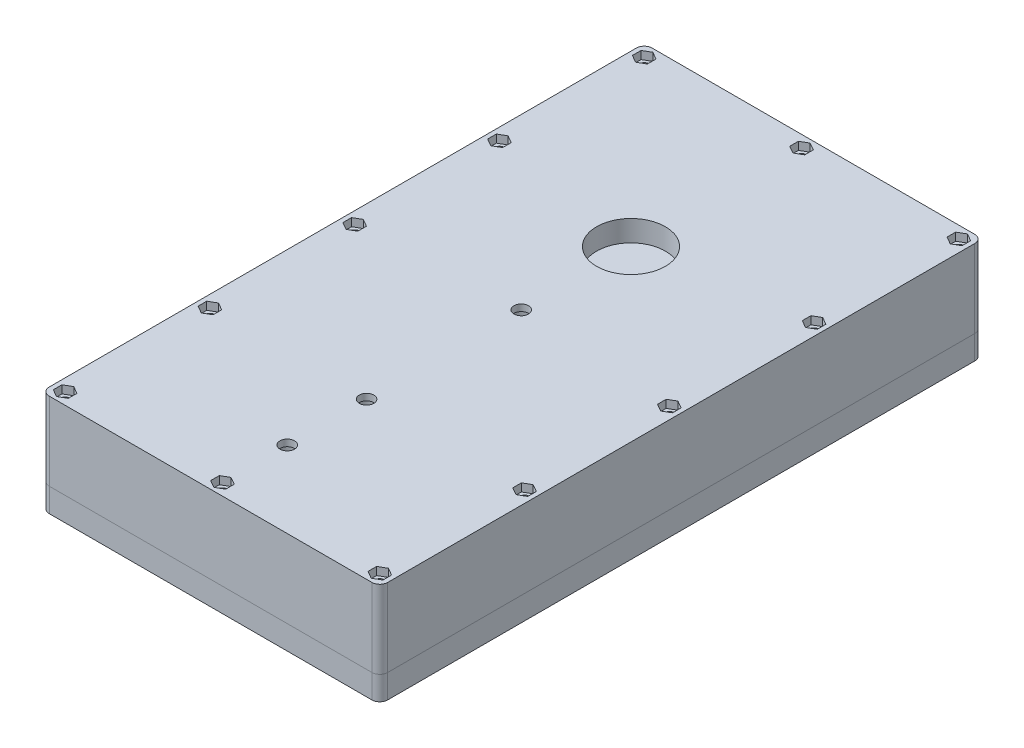
from build123d import *

# Parameters (mm, degrees)
SKETCH1_W                = 110
SKETCH1_H                = 210
SKETCH1_R                = 3.15
SKETCH1_R_2              = 2.75
SKETCH1_R_3              = 13
BOSS_EXTRUDE1_DEPTH      = 8
BOSS_EXTRUDE2_DEPTH      = 21.5
BOSS_EXTRUDE2_DEPTH_BACK = 8
SKETCH2_W                = 128
SKETCH2_H                = 228
SKETCH2_R                = 1.75
SKETCH2_W_2              = 110
SKETCH2_H_2              = 210
SKETCH3_W                = 128
SKETCH3_H                = 228
SKETCH3_R                = 11.5
SKETCH3_R_2              = 1.75
SKETCH3_R_3              = 3.15
SKETCH3_R_4              = 5.25
BOSS_EXTRUDE3_DEPTH      = 9
SKETCH4_R                = 2.86
CUT_EXTRUDE1_DEPTH       = 3.5
SKETCH5_R                = 2.75
CUT_EXTRUDE2_DEPTH       = 157.036053526
SKETCH6_R                = 4.36
CUT_EXTRUDE3_DEPTH       = 5.5
SKETCH7_R                = 7.5
SKETCH7_R_2              = 2.75
BOSS_EXTRUDE4_DEPTH      = 22.5
BOSS_EXTRUDE4_2_DEPTH    = 22.5
FILLET1_R                = 3
FILLET2_R                = 3
SKETCH8_R                = 3.15
BOSS_EXTRUDE5_DEPTH      = 3
BOSS_EXTRUDE6_START      = -3
SKETCH9_R                = 3.15
BOSS_EXTRUDE6_DEPTH      = 3
CUT_EXTRUDE4_DEPTH       = 3
CHAMFER1_SIZE            = 2
CHAMFER2_SIZE            = 1
CHAMFER3_SIZE            = 1


with BuildPart() as part:
    # Sketch1 → Boss-Extrude1 (new body)
    with BuildSketch(Plane(origin=(0, 0, 0), x_dir=(1, 0, 0), z_dir=(0, 1, 0))):
        with Locations((0, 25)):
            Rectangle(SKETCH1_W, SKETCH1_H)
        with Locations(Location((0, 0, 0), (0, 0, 270))):
            Circle(SKETCH1_R, mode=Mode.SUBTRACT)
        with Locations(Location((0, -60, 0), (0, 0, 270))):
            Circle(SKETCH1_R_2, mode=Mode.SUBTRACT)
        with Locations(Location((0, 70, 0), (0, 0, 270))):
            Circle(SKETCH1_R_3, mode=Mode.SUBTRACT)
    extrude(amount=BOSS_EXTRUDE1_DEPTH)

    # Sketch2 → Boss-Extrude2 (add, two sides: drawn at the far end of the back side and taken through both)
    with BuildSketch(Plane.XZ.offset(-BOSS_EXTRUDE2_DEPTH_BACK)):
        with Locations((0, -25)):
            Rectangle(SKETCH2_W, SKETCH2_H)
        with Locations(Location((-59.5, -79.75, 0), (0, 0, 270))):
            Circle(SKETCH2_R, mode=Mode.SUBTRACT)
        with Locations(Location((59.5, 84.5, 0), (0, 0, 270))):
            Circle(SKETCH2_R, mode=Mode.SUBTRACT)
        with Locations(Location((59.5, 29.75, 0), (0, 0, 270))):
            Circle(SKETCH2_R, mode=Mode.SUBTRACT)
        with Locations(Location((0, 84.5, 0), (0, 0, 270))):
            Circle(SKETCH2_R, mode=Mode.SUBTRACT)
        with Locations(Location((-59.5, 29.75, 0), (0, 0, 270))):
            Circle(SKETCH2_R, mode=Mode.SUBTRACT)
        with Locations(Location((-59.5, -25, 0), (0, 0, 270))):
            Circle(SKETCH2_R, mode=Mode.SUBTRACT)
        with Locations(Location((-59.5, 84.5, 0), (0, 0, 270))):
            Circle(SKETCH2_R, mode=Mode.SUBTRACT)
        with Locations(Location((59.5, -25, 0), (0, 0, 270))):
            Circle(SKETCH2_R, mode=Mode.SUBTRACT)
        with Locations(Location((59.5, -134.5, 0), (0, 0, 270))):
            Circle(SKETCH2_R, mode=Mode.SUBTRACT)
        with Locations(Location((59.5, -79.75, 0), (0, 0, 270))):
            Circle(SKETCH2_R, mode=Mode.SUBTRACT)
        with Locations(Location((0, -134.5, 0), (0, 0, 270))):
            Circle(SKETCH2_R, mode=Mode.SUBTRACT)
        with Locations(Location((-59.5, -134.5, 0), (0, 0, 270))):
            Circle(SKETCH2_R, mode=Mode.SUBTRACT)
        with Locations((0, -25)):
            Rectangle(SKETCH2_W_2, SKETCH2_H_2, mode=Mode.SUBTRACT)
    extrude(amount=BOSS_EXTRUDE2_DEPTH + BOSS_EXTRUDE2_DEPTH_BACK)

    # Sketch5 → Cut-Extrude2 (cut, through all)
    with BuildSketch(Plane.XZ):
        with Locations(Location((0, -28.5, 0), (0, 0, 270))):
            Circle(SKETCH5_R)
        with Locations(Location((0, 30, 0), (0, 0, 270))):
            Circle(SKETCH5_R)
    extrude(amount=-CUT_EXTRUDE2_DEPTH, mode=Mode.SUBTRACT)

    # Sketch6 → Cut-Extrude3 (cut)
    with BuildSketch(Plane.XZ):
        with Locations(Location((0, 30, 0), (0, 0, 270))):
            Circle(SKETCH6_R)
        with Locations(Location((0, -28.5, 0), (0, 0, 270))):
            Circle(SKETCH6_R)
        with Locations(Location((0, 60, 0), (0, 0, 270))):
            Circle(SKETCH6_R)
    extrude(amount=-CUT_EXTRUDE3_DEPTH, mode=Mode.SUBTRACT)

    # Fillet1
    fillet1_edges = [part.edges().sort_by_distance(p)[0] for p in [
        (55, -10.75, 80),
        (-55, -10.75, -130),
        (55, -10.75, -130),
        (-55, -10.75, 80),
        (-64, -6.75, -139),
        (64, -6.75, -139),
        (64, -6.75, 89),
        (-64, -6.75, 89),
    ]]
    fillet(fillet1_edges, radius=FILLET1_R)

    # Sketch9 → Boss-Extrude6 (add)
    with BuildSketch(Plane(origin=(0, 8, 0), x_dir=(1, 0, 0), z_dir=(0, 1, 0)).offset(BOSS_EXTRUDE6_START)):
        with Locations(Location((0, 0, 0), (0, 0, 90))):
            Circle(SKETCH9_R)
    extrude(amount=BOSS_EXTRUDE6_DEPTH)

    # Sketch10 → Cut-Extrude4 (cut)
    with BuildSketch(Plane(origin=(0, 8, 0), x_dir=(1, 0, 0), z_dir=(0, 1, 0))):
        Polygon((-59.5, 137.762029021), (-62.325, 136.13101451), (-62.325, 132.86898549), (-59.5, 131.237970979), (-56.675, 132.86898549), (-56.675, 136.13101451), align=None)
        Polygon((0, 137.762029021), (-2.825, 136.13101451), (-2.825, 132.86898549), (0, 131.237970979), (2.825, 132.86898549), (2.825, 136.13101451), align=None)
        Polygon((-59.5, 83.012029021), (-62.325, 81.38101451), (-62.325, 78.11898549), (-59.5, 76.487970979), (-56.675, 78.11898549), (-56.675, 81.38101451), align=None)
        Polygon((-59.5, 28.262029021), (-62.325, 26.63101451), (-62.325, 23.36898549), (-59.5, 21.737970979), (-56.675, 23.36898549), (-56.675, 26.63101451), align=None)
        Polygon((56.675, 26.63101451), (59.5, 28.262029021), (62.325, 26.63101451), (62.325, 23.36898549), (59.5, 21.737970979), (56.675, 23.36898549), align=None)
        Polygon((56.675, 81.38101451), (59.5, 83.012029021), (62.325, 81.38101451), (62.325, 78.11898549), (59.5, 76.487970979), (56.675, 78.11898549), align=None)
        Polygon((56.675, 136.13101451), (59.5, 137.762029021), (62.325, 136.13101451), (62.325, 132.86898549), (59.5, 131.237970979), (56.675, 132.86898549), align=None)
        Polygon((59.5, -87.762029021), (62.325, -86.13101451), (62.325, -82.86898549), (59.5, -81.237970979), (56.675, -82.86898549), (56.675, -86.13101451), align=None)
        Polygon((59.5, -33.012029021), (62.325, -31.38101451), (62.325, -28.11898549), (59.5, -26.487970979), (56.675, -28.11898549), (56.675, -31.38101451), align=None)
        Polygon((-56.675, -31.38101451), (-59.5, -33.012029021), (-62.325, -31.38101451), (-62.325, -28.11898549), (-59.5, -26.487970979), (-56.675, -28.11898549), align=None)
        Polygon((2.825, -86.13101451), (0, -87.762029021), (-2.825, -86.13101451), (-2.825, -82.86898549), (0, -81.237970979), (2.825, -82.86898549), align=None)
        Polygon((-56.675, -86.13101451), (-59.5, -87.762029021), (-62.325, -86.13101451), (-62.325, -82.86898549), (-59.5, -81.237970979), (-56.675, -82.86898549), align=None)
    extrude(amount=-CUT_EXTRUDE4_DEPTH, mode=Mode.SUBTRACT)

    # Chamfer2
    chamfer2_edges = [part.edges().sort_by_distance(p)[0] for p in [
        (0, 0, -3.15),
        (0, 0, 64.36),
        (0, 0, -24.14),
        (0, 0, 34.36),
    ]]
    chamfer(chamfer2_edges, length=CHAMFER2_SIZE)


with BuildPart() as body_2:
    # Sketch3 → Boss-Extrude3 (new body)
    with BuildSketch(Plane.XZ.offset(21.5)):
        with Locations((0, -25)):
            Rectangle(SKETCH3_W, SKETCH3_H)
        with Locations(Location((0, 60, 0), (0, 0, 270))):
            Circle(SKETCH3_R, mode=Mode.SUBTRACT)
        with Locations(Location((-15.5, 75.5, 0), (0, 0, 270))):
            Circle(SKETCH3_R_2, mode=Mode.SUBTRACT)
        with Locations(Location((15.5, 75.5, 0), (0, 0, 270))):
            Circle(SKETCH3_R_2, mode=Mode.SUBTRACT)
        with Locations(Location((15.5, 44.5, 0), (0, 0, 270))):
            Circle(SKETCH3_R_2, mode=Mode.SUBTRACT)
        with Locations(Location((-15.5, 44.5, 0), (0, 0, 270))):
            Circle(SKETCH3_R_2, mode=Mode.SUBTRACT)
        with Locations(Location((-59.5, -134.5, 0), (0, 0, 270))):
            Circle(SKETCH3_R_2, mode=Mode.SUBTRACT)
        with Locations(Location((0, -134.5, 0), (0, 0, 270))):
            Circle(SKETCH3_R_2, mode=Mode.SUBTRACT)
        with Locations(Location((59.5, -134.5, 0), (0, 0, 270))):
            Circle(SKETCH3_R_2, mode=Mode.SUBTRACT)
        with Locations(Location((59.5, -79.75, 0), (0, 0, 270))):
            Circle(SKETCH3_R_2, mode=Mode.SUBTRACT)
        with Locations(Location((-59.5, -79.75, 0), (0, 0, 270))):
            Circle(SKETCH3_R_2, mode=Mode.SUBTRACT)
        with Locations(Location((-59.5, -25, 0), (0, 0, 270))):
            Circle(SKETCH3_R_2, mode=Mode.SUBTRACT)
        with Locations(Location((-59.5, 29.75, 0), (0, 0, 270))):
            Circle(SKETCH3_R_2, mode=Mode.SUBTRACT)
        with Locations(Location((59.5, -25, 0), (0, 0, 270))):
            Circle(SKETCH3_R_2, mode=Mode.SUBTRACT)
        with Locations(Location((59.5, 29.75, 0), (0, 0, 270))):
            Circle(SKETCH3_R_2, mode=Mode.SUBTRACT)
        with Locations(Location((59.5, 84.5, 0), (0, 0, 270))):
            Circle(SKETCH3_R_2, mode=Mode.SUBTRACT)
        with Locations(Location((0, 84.5, 0), (0, 0, 270))):
            Circle(SKETCH3_R_2, mode=Mode.SUBTRACT)
        with Locations(Location((-59.5, 84.5, 0), (0, 0, 270))):
            Circle(SKETCH3_R_2, mode=Mode.SUBTRACT)
        with Locations(Location((0, 0, 0), (0, 0, 270))):
            Circle(SKETCH3_R_3, mode=Mode.SUBTRACT)
        with Locations(Location((0, -70, 0), (0, 0, 270))):
            Circle(SKETCH3_R_4, mode=Mode.SUBTRACT)
    extrude(amount=BOSS_EXTRUDE3_DEPTH)

    # Sketch4 → Cut-Extrude1 (cut)
    with BuildSketch(Plane(origin=(0, -21.5, 0), x_dir=(1, 0, 0), z_dir=(0, 1, 0))):
        with Locations(Location((-15.5, -44.5, 0), (0, 0, 270))):
            Circle(SKETCH4_R)
        with Locations(Location((15.5, -44.5, 0), (0, 0, 270))):
            Circle(SKETCH4_R)
        with Locations(Location((15.5, -75.5, 0), (0, 0, 270))):
            Circle(SKETCH4_R)
        with Locations(Location((-15.5, -75.5, 0), (0, 0, 270))):
            Circle(SKETCH4_R)
    extrude(amount=-CUT_EXTRUDE1_DEPTH, mode=Mode.SUBTRACT)

    # Fillet2
    fillet2_edges = [body_2.edges().sort_by_distance(p)[0] for p in [
        (-64, -26, 89),
        (64, -26, 89),
        (64, -26, -139),
        (-64, -26, -139),
    ]]
    fillet(fillet2_edges, radius=FILLET2_R)

    # Sketch8 → Boss-Extrude5 (add)
    with BuildSketch(Plane.XZ.offset(30.5)):
        with Locations(Location((0, 0, 0), (0, 0, 270))):
            Circle(SKETCH8_R)
    extrude(amount=-BOSS_EXTRUDE5_DEPTH)

    # Chamfer1
    chamfer1_edges = [body_2.edges().sort_by_distance(p)[0] for p in [
        (0, -21.5, 71.5),
    ]]
    chamfer(chamfer1_edges, length=CHAMFER1_SIZE)

    # Chamfer3
    chamfer3_edges = [body_2.edges().sort_by_distance(p)[0] for p in [
        (0, -21.5, 3.15),
        (0, -21.5, -64.75),
    ]]
    chamfer(chamfer3_edges, length=CHAMFER3_SIZE)


with BuildPart() as body_3:
    # Sketch7 → Boss-Extrude4 (new body)
    with BuildSketch(Plane(origin=(0, 8, 0), x_dir=(1, 0, 0), z_dir=(0, 1, 0))):
        with Locations(Location((0, 28.5, 0), (0, 0, 90))):
            Circle(SKETCH7_R)
        with Locations(Location((0, 28.5, 0), (0, 0, 90))):
            Circle(SKETCH7_R_2, mode=Mode.SUBTRACT)
    extrude(amount=BOSS_EXTRUDE4_DEPTH)


with BuildPart() as body_4:
    # Sketch7 → Boss-Extrude4 2 (new body)
    with BuildSketch(Plane(origin=(0, 8, 0), x_dir=(1, 0, 0), z_dir=(0, 1, 0))):
        with Locations(Location((0, -30, 0), (0, 0, 90))):
            Circle(SKETCH7_R)
        with Locations(Location((0, -30, 0), (0, 0, 90))):
            Circle(SKETCH7_R_2, mode=Mode.SUBTRACT)
    extrude(amount=BOSS_EXTRUDE4_2_DEPTH)


solid = Compound([part.part, body_2.part])
